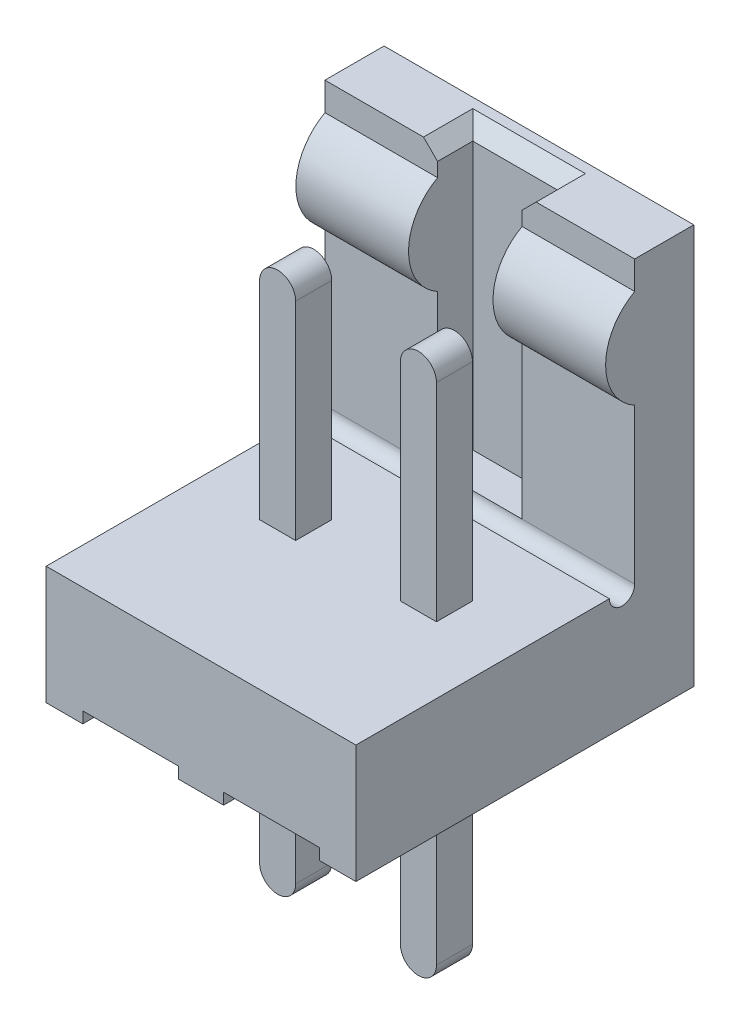
from build123d import *

# Parameters (mm, degrees)
BOSS_EXTRUDE1_DEPTH      = 2.75
BOSS_EXTRUDE1_DEPTH_BACK = 2.75
SKETCH2_W                = 1.5
SKETCH2_H                = 1.25
CUT_EXTRUDE1_DEPTH       = 7.446898479
CHAMFER1_SIZE            = 0.25
SKETCH3_W                = 1.7
SKETCH3_H                = 0.2
CUT_EXTRUDE2_DEPTH       = 10.693941407
BOSS_EXTRUDE2_DEPTH      = 4
BOSS_EXTRUDE2_DEPTH_BACK = 5.6
SKETCH4_W                = 0.64
SKETCH4_H                = 0.64
FILLET1_RADIUS           = 0.32
FILLET1_LENGTH           = 0.64
FILLET2_RADIUS           = 0.32
FILLET2_LENGTH           = 0.64


with BuildPart() as part:
    # Sketch1 → Boss-Extrude1 (new, two sides: drawn at the far end of the back side and taken through both)
    with BuildSketch(Plane(origin=(0, 0, 0), x_dir=(0, 0, -1), z_dir=(1, 0, 0)).offset(-BOSS_EXTRUDE1_DEPTH_BACK)):
        with BuildLine():
            Line((-3, 0), (3, 0))
            Line((3, 0), (3, 7.1))
            Line((3, 7.1), (1.95, 7.1))
            Line((1.95, 7.1), (1.95, 6.6))
            ThreePointArc((1.95, 6.6), (1.434122918, 5.725), (1.95, 4.85))
            Line((1.95, 4.85), (1.95, 2.1))
            ThreePointArc((1.95, 2.1), (1.725, 1.875), (1.5, 2.1))
            Line((1.5, 2.1), (-3, 2.1))
            Line((-3, 2.1), (-3, 0))
        make_face()
    extrude(amount=BOSS_EXTRUDE1_DEPTH + BOSS_EXTRUDE1_DEPTH_BACK)

    # Sketch2 → Cut-Extrude1 (cut, through all)
    with BuildSketch(Plane(origin=(0, 2.1, 0), x_dir=(1, 0, 0), z_dir=(0, 1, 0))):
        with Locations((0, 1.95)):
            Rectangle(SKETCH2_W, SKETCH2_H)
    extrude(amount=CUT_EXTRUDE1_DEPTH, mode=Mode.SUBTRACT)

    # Chamfer1
    chamfer1_edges = [part.edges().sort_by_distance(p)[0] for p in [
        (0.75, 7.1, -2.2625),
        (-0.75, 7.1, -2.2625),
        (0, 7.1, -2.575),
    ]]
    chamfer(chamfer1_edges, length=CHAMFER1_SIZE)

    # Sketch3 → Cut-Extrude2 (cut, through all)
    with BuildSketch(Plane.XY.offset(3)):
        with Locations((-1.25, 0.1)):
            Rectangle(SKETCH3_W, SKETCH3_H)
        with Locations((1.25, 0.1)):
            Rectangle(SKETCH3_W, SKETCH3_H)
    extrude(amount=-CUT_EXTRUDE2_DEPTH, mode=Mode.SUBTRACT)


with BuildPart() as body_2:
    # Sketch4 → Boss-Extrude2 (new, two sides: drawn at the far end of the back side and taken through both)
    with BuildSketch(Plane(origin=(0, 2.1, 0), x_dir=(1, 0, 0), z_dir=(0, 1, 0)).offset(-BOSS_EXTRUDE2_DEPTH_BACK)):
        with Locations((-1.25, -0.07)):
            Rectangle(SKETCH4_W, SKETCH4_H)
    extrude(amount=BOSS_EXTRUDE2_DEPTH + BOSS_EXTRUDE2_DEPTH_BACK)

    # Fillet1: full round fillet: the end face becomes a half cylinder, R = half its width
    fillet1_face = Plane((-1.25, 6.1, 0.07), x_dir=(0, 0, -1), z_dir=(0, 1, 0))  # on the end face: x along it, z out of the body
    fillet1_slab = fillet1_face.offset(-FILLET1_RADIUS / 2) * Box(FILLET1_LENGTH, 2 * FILLET1_RADIUS, FILLET1_RADIUS, mode=Mode.PRIVATE)  # the body's end, R deep
    fillet1_round = Plane((-1.25, 5.78, 0.07), x_dir=(0, 1, 0), z_dir=(0, 0, -1)) * Cylinder(FILLET1_RADIUS, FILLET1_LENGTH, mode=Mode.PRIVATE)  # its axis R under the face
    add(fillet1_slab - fillet1_round, mode=Mode.SUBTRACT)

    # Fillet2: full round fillet: the end face becomes a half cylinder, R = half its width
    fillet2_face = Plane((-1.25, -3.5, 0.07), x_dir=(0, 0, -1), z_dir=(0, -1, 0))  # on the end face: x along it, z out of the body
    fillet2_slab = fillet2_face.offset(-FILLET2_RADIUS / 2) * Box(FILLET2_LENGTH, 2 * FILLET2_RADIUS, FILLET2_RADIUS, mode=Mode.PRIVATE)  # the body's end, R deep
    fillet2_round = Plane((-1.25, -3.18, 0.07), x_dir=(0, -1, 0), z_dir=(0, 0, -1)) * Cylinder(FILLET2_RADIUS, FILLET2_LENGTH, mode=Mode.PRIVATE)  # its axis R under the face
    add(fillet2_slab - fillet2_round, mode=Mode.SUBTRACT)


with BuildPart() as body_3:
    # Mirror1: mirrored copy
    add(body_2.part.mirror(Plane(origin=(0, 0, 0), x_dir=(0, 0, 1), z_dir=(1, 0, 0))))


solid = Compound([part.part, body_2.part, body_3.part])
